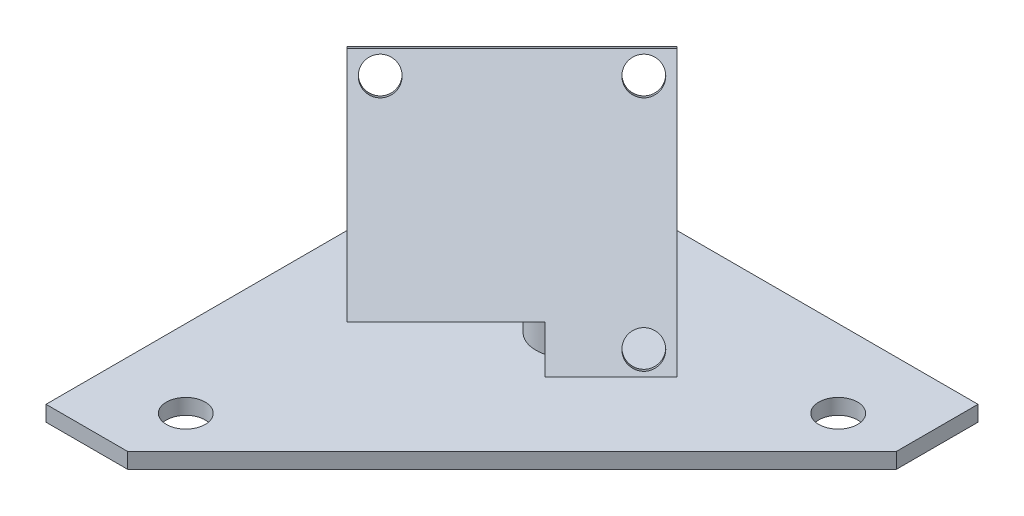
from build123d import *

# Parameters (mm, degrees)
SKETCH_1_R      = 2.5
EXTRUDE_1_DEPTH = 2
SKETCH_2_R      = 2
EXTRUDE_3_DEPTH = 2
EXTRUDE_4_REACH = 91.774
SKETCH_4_R      = 4


with BuildPart() as part:
    # 草图1 → 凸台-拉伸1 (new body)
    with BuildSketch(Plane(origin=(0, 0, 0), x_dir=(1, 0, 0), z_dir=(0, 1, 0))):
        Polygon((10.502525317, -60), (60, -10.502525317), (60, 0), (20, 0), (20, -20), (0, -20), (0, -60), align=None)
        with Locations(Location((10, -52, 0), (0, 0, 270))):
            Circle(SKETCH_1_R, mode=Mode.SUBTRACT)
        with Locations(Location((52, -10, 0), (0, 0, 270))):
            Circle(SKETCH_1_R, mode=Mode.SUBTRACT)
    extrude(amount=EXTRUDE_1_DEPTH)



with BuildPart() as body_2:
    # 草图2 → 凸台-拉伸3 (new body)
    with BuildSketch(Plane(origin=(23.112372436, 18.871173071, 23.112372436), x_dir=(-0.7071067811865475, 0, 0.7071067811865477), z_dir=(0.6123724356957955, 0.4999999999999981, 0.6123724356957954))):
        Polygon((-3, 16.786030205), (-15, 16.786030205), (-15, -13.213969795), (15, -13.213969795), (15, 11.786030205), (-3, 11.786030205), align=None)
        with Locations(Location((-12, -10.713969795, 0), (0, 0, 180))):
            Circle(SKETCH_2_R, mode=Mode.SUBTRACT)
        with Locations(Location((12, -10.713969795, 0), (0, 0, 180))):
            Circle(SKETCH_2_R, mode=Mode.SUBTRACT)
        with Locations(Location((-12, 14.286030205, 0), (0, 0, 180))):
            Circle(SKETCH_2_R, mode=Mode.SUBTRACT)
    extrude(amount=EXTRUDE_3_DEPTH)


with BuildPart() as part_1:
    add(part.part)

    add(body_2.part)  # 凸台-拉伸4 merges body 2
    # 凸台-拉伸4: up to this plane
    extrude_4_end = Plane(origin=(23.112372436, 18.871173071, 23.112372436), z_dir=(0.6123724356957954, 0.4999999999999981, 0.6123724356957952))
    # 草图4 → 凸台-拉伸4 (add, up to the surface)
    with BuildSketch(Plane(origin=(0, 2, 0), x_dir=(1, 0, 0), z_dir=(0, 1, 0)), mode=Mode.PRIVATE) as extrude_4_sk1:
        with Locations(Location((25.511596423, -18.440528611, 0), (0, 0, 315))):
            Circle(SKETCH_4_R)
    extrude_4_tool1 = split(extrude(extrude_4_sk1.sketch, amount=EXTRUDE_4_REACH, mode=Mode.PRIVATE), bisect_by=extrude_4_end, keep=Keep.BOTH, mode=Mode.PRIVATE)
    add(extrude_4_tool1.solids().sort_by_distance((25.511596, 2, 18.440529))[0])


solid = part_1.part
